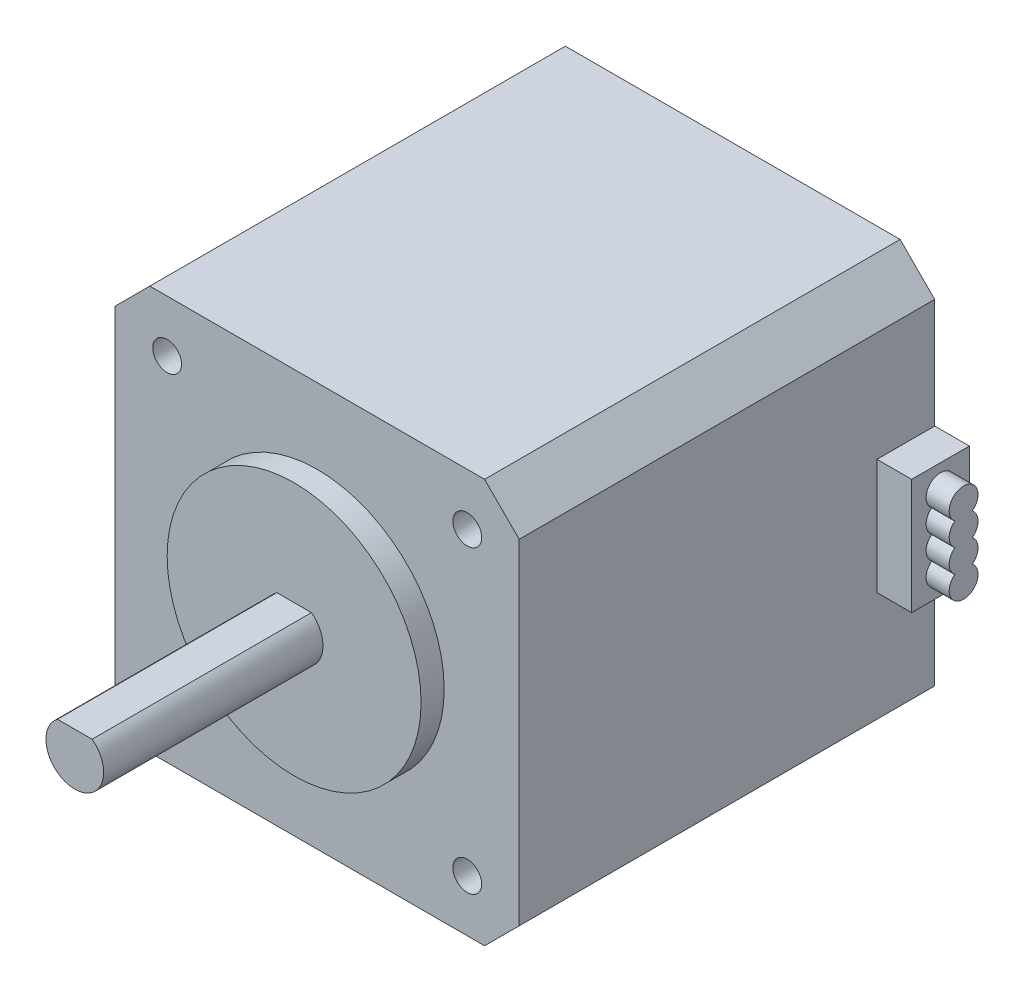
from build123d import *

# Parameters (mm, degrees)
BOSS_EXTRUDE1_DEPTH       = 36
SKETCH1_3_R               = 11
BOSS_EXTRUDE2_DEPTH       = 2
M3X0_5_TAPPED_HOLE1_D     = 2.5
M3X0_5_TAPPED_HOLE1_DEPTH = 5
M3X0_5_TAPPED_HOLE1_TIP   = 0.751075774
BOSS_EXTRUDE3_DEPTH       = 21
SKETCH4_W                 = 5
SKETCH4_H                 = 10
BOSS_EXTRUDE4_DEPTH       = 3
BOSS_EXTRUDE5_START       = 3
SKETCH4_3_R               = 1.25
BOSS_EXTRUDE5_DEPTH       = 2


with BuildPart() as part:
    # Sketch1 → Boss-Extrude1 (new body)
    with BuildSketch(Plane.XY):
        Polygon((-14.5, 17.5), (-17.5, 14.5), (-17.5, -14.5), (-14.5, -17.5), (14.5, -17.5), (17.5, -14.5), (17.5, 14.5), (14.5, 17.5), align=None)
    extrude(amount=-BOSS_EXTRUDE1_DEPTH)

    # Sketch1<3> → Boss-Extrude2 (add)
    with BuildSketch(Plane.XY):
        Circle(SKETCH1_3_R)
    extrude(amount=BOSS_EXTRUDE2_DEPTH)

    # M3x0.5 Tapped Hole1
    with Locations(Plane.XY):
        with Locations((13, 13), (-13, 13), (-13, -13), (13, -13)):
            Hole(M3X0_5_TAPPED_HOLE1_D / 2, depth=M3X0_5_TAPPED_HOLE1_DEPTH)
            with Locations((0, 0, -(M3X0_5_TAPPED_HOLE1_DEPTH + M3X0_5_TAPPED_HOLE1_TIP / 2))):  # 118° drill point
                Cone(0, M3X0_5_TAPPED_HOLE1_D / 2, M3X0_5_TAPPED_HOLE1_TIP, mode=Mode.SUBTRACT)

    # Sketch1<4> → Boss-Extrude3 (add)
    with BuildSketch(Plane.XY):
        with BuildLine():
            Line((-1.5, 2), (1.5, 2))
            ThreePointArc((1.5, 2), (0, -2.5), (-1.5, 2))
        make_face()
    extrude(amount=BOSS_EXTRUDE3_DEPTH)

    # Sketch4 → Boss-Extrude4 (add)
    with BuildSketch(Plane(origin=(17.5, 0, 0), x_dir=(0, 0, -1), z_dir=(1, 0, 0))):
        with Locations((33.5, 0)):
            Rectangle(SKETCH4_W, SKETCH4_H)
    extrude(amount=BOSS_EXTRUDE4_DEPTH)

    # Sketch4<3> → Boss-Extrude5 (add)
    with BuildSketch(Plane(origin=(17.5, 0, 0), x_dir=(0, 0, -1), z_dir=(1, 0, 0)).offset(BOSS_EXTRUDE5_START)):
        with Locations((33.5, 3)):
            Circle(SKETCH4_3_R)
        with Locations((33.5, 1)):
            Circle(SKETCH4_3_R)
        with Locations((33.5, -1)):
            Circle(SKETCH4_3_R)
        with Locations((33.5, -3)):
            Circle(SKETCH4_3_R)
    extrude(amount=BOSS_EXTRUDE5_DEPTH)


solid = part.part
